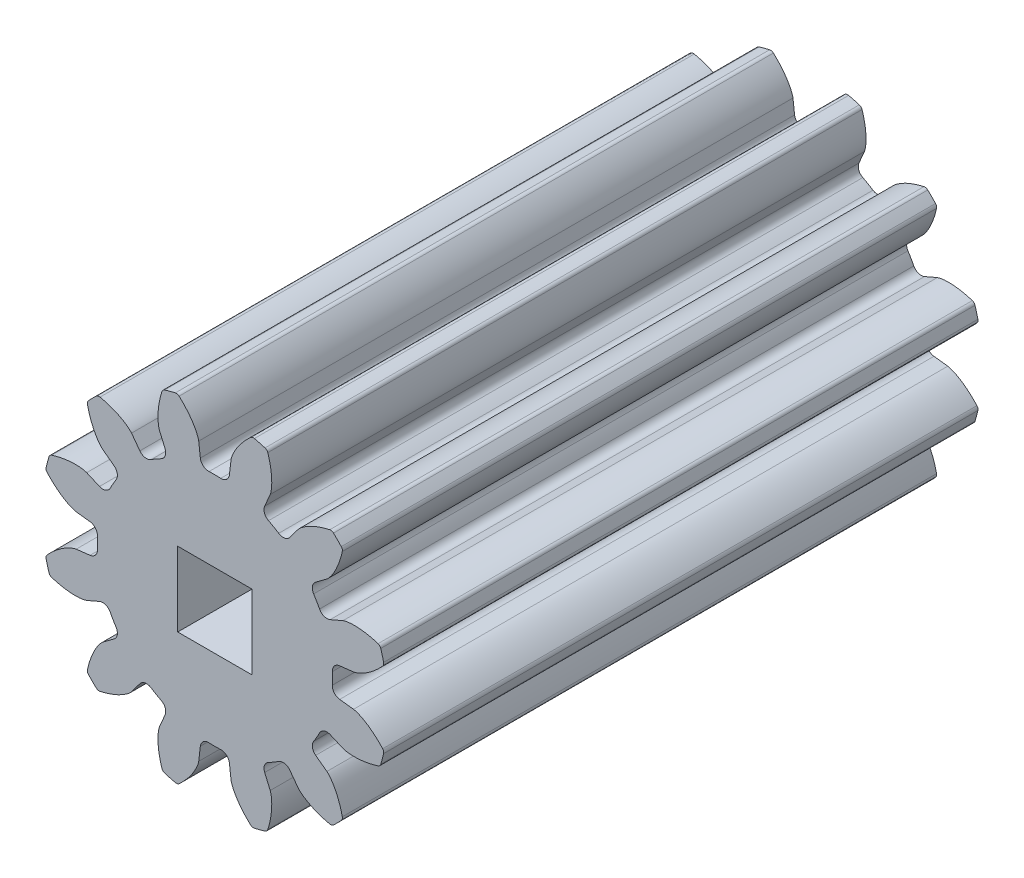
from build123d import *

# Parameters (mm, degrees)
SKETCH1_R                                 = 7.408333333
BOSS_EXTRUDE1_DEPTH                       = 25.4
CUT_EXTRUDE_DCLTBC_DEPTH                  = 28.475931386
FILLET_TIP_DCLTBC_R                       = 0.177538081
FILLET_ROOT_DCLTBC_R                      = 0.355076163
CIRPATTERN_DCLTBC_COUNT                   = 12
FILLET_TIP_DCLTBC_OF_CIRPATTERN_DCLTBC_R  = 0.177538081
FILLET_ROOT_DCLTBC_OF_CIRPATTERN_DCLTBC_R = 0.355076163
SKETCH4_W                                 = 3.175
SKETCH4_H                                 = 3.175
CUT_EXTRUDE2_DEPTH                        = 28.374396433


with BuildPart() as part:
    # Sketch1 → Boss-Extrude1 (new body)
    with BuildSketch(Plane.XY):
        Circle(SKETCH1_R)
    extrude(amount=BOSS_EXTRUDE1_DEPTH)

    # DCLTBC → Cut-Extrude-DCLTBC (cut, through all)
    with BuildSketch(Plane.XY):
        with BuildLine():
            Line((-0.690598508, 5.926950078), (-0.581811335, 4.993301754))
            ThreePointArc((-0.581811335, 4.993301754), (0, 5.027083333), (0.581811335, 4.993301754))
            Line((0.581811335, 4.993301754), (0.690598508, 5.926950078))
            add(Edge.make_bspline(
                [(0.690598508, 5.926950078), (0.690911872, 5.929318191), (0.691904892, 5.935944647), (0.694232443, 5.948407954), (0.69866684, 5.96863478), (0.70524939, 5.994230847), (0.714822349, 6.027084964), (0.727462413, 6.065467787), (0.74277265, 6.107282331), (0.760950457, 6.152345854), (0.780422108, 6.196898763), (0.801081108, 6.240942495), (0.822769247, 6.284441008), (0.8503395, 6.336662498), (0.885198626, 6.398612769), (0.92853373, 6.469984516), (0.980716028, 6.54965538), (1.037091207, 6.629400976), (1.095172788, 6.706647925), (1.156800213, 6.78320647), (1.218511327, 6.856219389), (1.285554849, 6.930432721), (1.348944008, 6.998115798), (1.423150182, 7.07205666), (1.483972917, 7.131183599), (1.549410219, 7.190627906), (1.581641114, 7.219315962), (1.598273068, 7.233873511)],
                knots=[0, 0, 0, 0, 0, 0.005376749, 0.015083688, 0.02853182, 0.046610139, 0.064854849, 0.092110525, 0.119476176, 0.146842496, 0.174208854, 0.201574956, 0.228941013, 0.256307345, 0.307035032, 0.361767352, 0.416499661, 0.471231937, 0.525964282, 0.580696615, 0.635428982, 0.690161387, 0.744893688, 0.799626082, 0.854358408, 0.909090915, 0.909090915, 0.909090915, 0.909090915, 0.909090915], degree=4))
            ThreePointArc((1.598273068, 7.233873511), (0, 7.408333333), (-1.598273068, 7.233873511))
            add(Edge.make_bspline(
                [(-0.690598508, 5.926950078), (-0.690911872, 5.929318191), (-0.691904892, 5.935944647), (-0.694232443, 5.948407954), (-0.69866684, 5.96863478), (-0.70524939, 5.994230847), (-0.714822349, 6.027084964), (-0.727462413, 6.065467787), (-0.74277265, 6.107282331), (-0.760950457, 6.152345854), (-0.780422108, 6.196898763), (-0.801081108, 6.240942495), (-0.822769247, 6.284441008), (-0.8503395, 6.336662498), (-0.885198626, 6.398612769), (-0.92853373, 6.469984516), (-0.980716028, 6.54965538), (-1.037091207, 6.629400976), (-1.095172788, 6.706647925), (-1.156800213, 6.78320647), (-1.218511327, 6.856219389), (-1.285554849, 6.930432721), (-1.348944008, 6.998115798), (-1.423150182, 7.07205666), (-1.483972917, 7.131183599), (-1.549410219, 7.190627906), (-1.581641114, 7.219315962), (-1.598273068, 7.233873511)],
                knots=[0, 0, 0, 0, 0, 0.005376749, 0.015083688, 0.02853182, 0.046610139, 0.064854849, 0.092110525, 0.119476176, 0.146842496, 0.174208854, 0.201574956, 0.228941013, 0.256307345, 0.307035032, 0.361767352, 0.416499661, 0.471231937, 0.525964282, 0.580696615, 0.635428982, 0.690161387, 0.744893688, 0.799626082, 0.854358408, 0.909090915, 0.909090915, 0.909090915, 0.909090915, 0.909090915], degree=4))
        make_face()
    cut_extrude_dcltbc = extrude(amount=CUT_EXTRUDE_DCLTBC_DEPTH, mode=Mode.SUBTRACT)

    # Fillet-Tip-DCLTBC
    fillet_tip_dcltbc_edges = [part.edges().sort_by_distance(p)[0] for p in [
        (1.598273068, 7.233873511, 12.7),
        (-1.598273068, 7.233873511, 12.7),
    ]]
    fillet(fillet_tip_dcltbc_edges, radius=FILLET_TIP_DCLTBC_R)

    # Fillet-Root-DCLTBC
    fillet_root_dcltbc_edges = [part.edges().sort_by_distance(p)[0] for p in [
        (0.581811335, 4.993301754, 12.7),
        (-0.581811335, 4.993301754, 12.7),
    ]]
    fillet(fillet_root_dcltbc_edges, radius=FILLET_ROOT_DCLTBC_R)

    # CirPattern-DCLTBC: Cut-Extrude-DCLTBC ×12 about axis
    cirpattern_dcltbc_axis = Axis((0, 0, 25.4), (0, 0, 1))
    for i in range(1, CIRPATTERN_DCLTBC_COUNT):
        add(cut_extrude_dcltbc.rotate(cirpattern_dcltbc_axis, i * 360 / CIRPATTERN_DCLTBC_COUNT), mode=Mode.SUBTRACT)

    # Fillet-Tip-DCLTBC of CirPattern-DCLTBC
    fillet_tip_dcltbc_of_cirpattern_dcltbc_edges = [part.edges().sort_by_distance(p)[0] for p in [
        (-2.232791676, 7.063854763, 12.7),
        (-5.001081835, 5.465581694, 12.7),
        (-5.465581694, 5.001081835, 12.7),
        (-7.063854763, 2.232791676, 12.7),
        (-7.233873511, 1.598273068, 12.7),
        (-7.233873511, -1.598273068, 12.7),
        (-7.063854763, -2.232791676, 12.7),
        (-5.465581694, -5.001081835, 12.7),
        (-5.001081835, -5.465581694, 12.7),
        (-2.232791676, -7.063854763, 12.7),
        (-1.598273068, -7.233873511, 12.7),
        (1.598273068, -7.233873511, 12.7),
        (2.232791676, -7.063854763, 12.7),
        (5.001081835, -5.465581694, 12.7),
        (5.465581694, -5.001081835, 12.7),
        (7.063854763, -2.232791676, 12.7),
        (7.233873511, -1.598273068, 12.7),
        (7.233873511, 1.598273068, 12.7),
        (7.063854763, 2.232791676, 12.7),
        (5.465581694, 5.001081835, 12.7),
        (5.001081835, 5.465581694, 12.7),
        (2.232791676, 7.063854763, 12.7),
    ]]
    fillet(fillet_tip_dcltbc_of_cirpattern_dcltbc_edges, radius=FILLET_TIP_DCLTBC_OF_CIRPATTERN_DCLTBC_R)

    # Fillet-Root-DCLTBC of CirPattern-DCLTBC
    fillet_root_dcltbc_of_cirpattern_dcltbc_edges = [part.edges().sort_by_distance(p)[0] for p in [
        (-1.99278748, 4.615231836, 12.7),
        (-3.000514274, 4.0334205, 12.7),
        (-4.0334205, 3.000514274, 12.7),
        (-4.615231836, 1.99278748, 12.7),
        (-4.993301754, 0.581811335, 12.7),
        (-4.993301754, -0.581811335, 12.7),
        (-4.615231836, -1.99278748, 12.7),
        (-4.0334205, -3.000514274, 12.7),
        (-3.000514274, -4.0334205, 12.7),
        (-1.99278748, -4.615231836, 12.7),
        (-0.581811335, -4.993301754, 12.7),
        (0.581811335, -4.993301754, 12.7),
        (1.99278748, -4.615231836, 12.7),
        (3.000514274, -4.0334205, 12.7),
        (4.0334205, -3.000514274, 12.7),
        (4.615231836, -1.99278748, 12.7),
        (4.993301754, -0.581811335, 12.7),
        (4.993301754, 0.581811335, 12.7),
        (4.615231836, 1.99278748, 12.7),
        (4.0334205, 3.000514274, 12.7),
        (3.000514274, 4.0334205, 12.7),
        (1.99278748, 4.615231836, 12.7),
    ]]
    fillet(fillet_root_dcltbc_of_cirpattern_dcltbc_edges, radius=FILLET_ROOT_DCLTBC_OF_CIRPATTERN_DCLTBC_R)

    # Sketch4 → Cut-Extrude2 (cut, through all)
    with BuildSketch(Plane.XY.offset(25.4)):
        Rectangle(SKETCH4_W, SKETCH4_H)
    extrude(amount=-CUT_EXTRUDE2_DEPTH, mode=Mode.SUBTRACT)


solid = part.part
